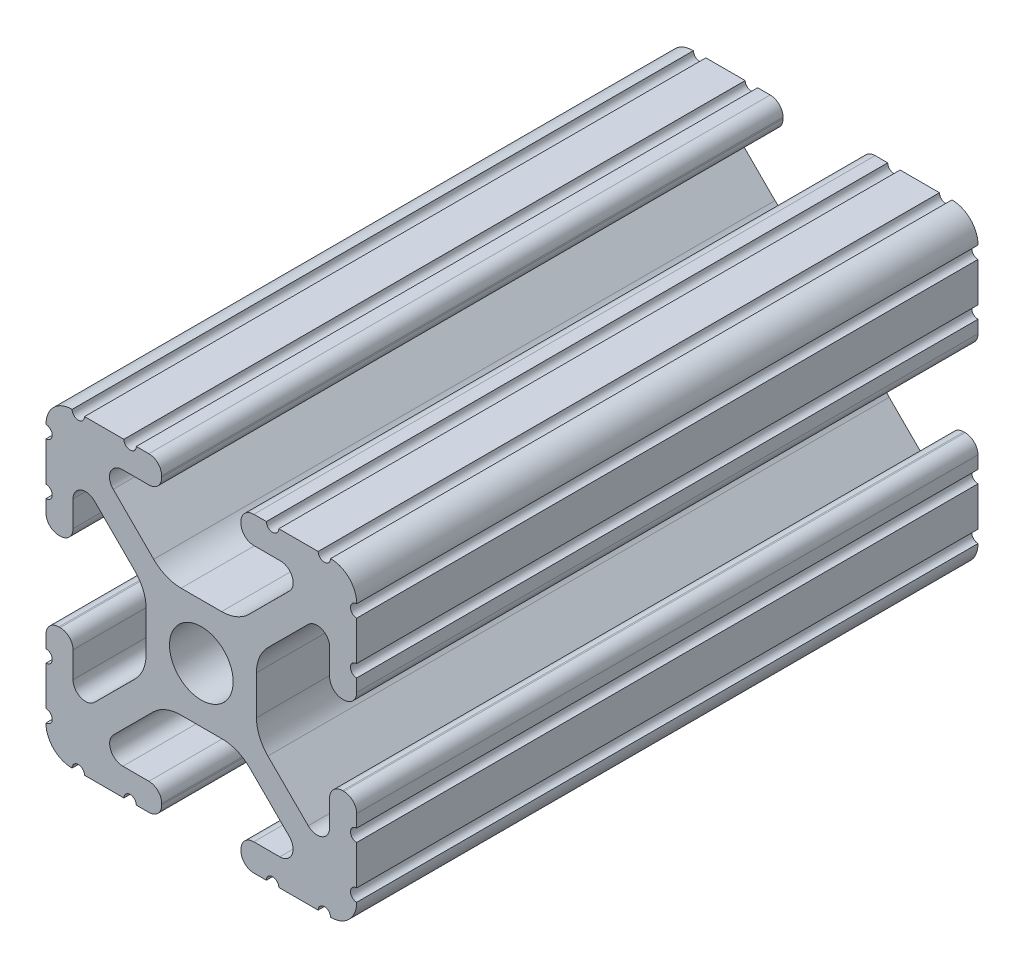
from build123d import *

# Parameters (mm, degrees)
SKETCH1_R           = 2.6035
BOSS_EXTRUDE1_DEPTH = 25.4


with BuildPart() as part:
    # Sketch1 → Boss-Extrude1 (new, symmetric)
    with BuildSketch(Plane.XY):
        with BuildLine():
            Line((-7.179650497, -8.645192506), (-3.952270251, -5.423690499))
            ThreePointArc((-3.952270251, -5.423690499), (-2.922936451, -4.736929036), (-1.709253557, -4.4958))
            Line((-1.709253557, -4.4958), (1.709253557, -4.4958))
            ThreePointArc((1.709253557, -4.4958), (2.922936451, -4.736929036), (3.952270251, -5.423690499))
            Line((3.952270251, -5.423690499), (7.179650497, -8.645192506))
            ThreePointArc((7.179650497, -8.645192506), (7.41473083, -9.822813117), (6.416408329, -10.4902))
            Line((6.416408329, -10.4902), (4.287512407, -10.4902))
            ThreePointArc((4.287512407, -10.4902), (3.54574862, -10.79744862), (3.2385, -11.539212407))
            Line((3.2385, -11.539212407), (3.2385, -11.650987593))
            ThreePointArc((3.2385, -11.650987593), (3.54574862, -12.39275138), (4.287512407, -12.7))
            Line((4.287512407, -12.7), (5.317126718, -12.7))
            ThreePointArc((5.317126718, -12.7), (5.825126718, -12.192), (6.333126718, -12.7))
            Line((6.333126718, -12.7), (9.550443118, -12.7))
            ThreePointArc((9.550443118, -12.7), (10.058366869, -12.192000006), (10.566443095, -12.699847501))
            ThreePointArc((10.566443095, -12.699847501), (12.082537762, -12.08250727), (12.699846982, -10.566399977))
            ThreePointArc((12.699846982, -10.566399977), (12.192000006, -10.058323491), (12.7, -9.5504))
            Line((12.7, -9.5504), (12.7, -6.3330836))
            ThreePointArc((12.7, -6.3330836), (12.192, -5.8250836), (12.7, -5.3170836))
            Line((12.7, -5.3170836), (12.7, -4.287469289))
            ThreePointArc((12.7, -4.287469289), (12.39275138, -3.545705502), (11.650987593, -3.238456882))
            Line((11.650987593, -3.238456882), (11.539212407, -3.238456882))
            ThreePointArc((11.539212407, -3.238456882), (10.79744862, -3.545705502), (10.4902, -4.287469289))
            Line((10.4902, -4.287469289), (10.4902, -6.402089023))
            ThreePointArc((10.4902, -6.402089023), (9.856505071, -7.351067942), (8.737131347, -7.129408934))
            Line((8.737131347, -7.129408934), (5.441005833, -3.840816462))
            ThreePointArc((5.441005833, -3.840816462), (4.750877967, -2.809883091), (4.5085, -1.593185507))
            Line((4.5085, -1.593185507), (4.5085, 1.593185507))
            ThreePointArc((4.5085, 1.593185507), (4.750877967, 2.809883091), (5.441005833, 3.840816462))
            Line((5.441005833, 3.840816462), (8.737131347, 7.129408934))
            ThreePointArc((8.737131347, 7.129408934), (9.856505071, 7.351067942), (10.4902, 6.402089023))
            Line((10.4902, 6.402089023), (10.4902, 4.287469289))
            ThreePointArc((10.4902, 4.287469289), (10.79744862, 3.545705502), (11.539212407, 3.238456882))
            Line((11.539212407, 3.238456882), (11.650987593, 3.238456882))
            ThreePointArc((11.650987593, 3.238456882), (12.39275138, 3.545705502), (12.7, 4.287469289))
            Line((12.7, 4.287469289), (12.7, 5.3170836))
            ThreePointArc((12.7, 5.3170836), (12.192, 5.8250836), (12.7, 6.3330836))
            Line((12.7, 6.3330836), (12.7, 9.5504))
            ThreePointArc((12.7, 9.5504), (12.192000006, 10.058323491), (12.699846982, 10.566399977))
            ThreePointArc((12.699846982, 10.566399977), (12.082537762, 12.08250727), (10.566443095, 12.699847501))
            ThreePointArc((10.566443095, 12.699847501), (10.058366869, 12.192000006), (9.550443118, 12.7))
            Line((9.550443118, 12.7), (6.333126718, 12.7))
            ThreePointArc((6.333126718, 12.7), (5.825126718, 12.192), (5.317126718, 12.7))
            Line((5.317126718, 12.7), (4.287512407, 12.7))
            ThreePointArc((4.287512407, 12.7), (3.54574862, 12.39275138), (3.2385, 11.650987593))
            Line((3.2385, 11.650987593), (3.2385, 11.539212407))
            ThreePointArc((3.2385, 11.539212407), (3.54574862, 10.79744862), (4.287512407, 10.4902))
            Line((4.287512407, 10.4902), (6.476788598, 10.4902))
            ThreePointArc((6.476788598, 10.4902), (7.432222385, 9.85140422), (7.207036008, 8.724370562))
            Line((7.207036008, 8.724370562), (3.898272566, 5.423169045))
            ThreePointArc((3.898272566, 5.423169045), (2.869120213, 4.736787962), (1.655778399, 4.4958))
            Line((1.655778399, 4.4958), (-1.655778399, 4.4958))
            ThreePointArc((-1.655778399, 4.4958), (-2.869120213, 4.736787962), (-3.898272566, 5.423169045))
            Line((-3.898272566, 5.423169045), (-7.207036008, 8.724370562))
            ThreePointArc((-7.207036008, 8.724370562), (-7.432222385, 9.85140422), (-6.476788598, 10.4902))
            Line((-6.476788598, 10.4902), (-4.287512407, 10.4902))
            ThreePointArc((-4.287512407, 10.4902), (-3.54574862, 10.79744862), (-3.2385, 11.539212407))
            Line((-3.2385, 11.539212407), (-3.2385, 11.650987593))
            ThreePointArc((-3.2385, 11.650987593), (-3.54574862, 12.39275138), (-4.287512407, 12.7))
            Line((-4.287512407, 12.7), (-5.317126718, 12.7))
            ThreePointArc((-5.317126718, 12.7), (-5.825126718, 12.192), (-6.333126718, 12.7))
            Line((-6.333126718, 12.7), (-9.550443118, 12.7))
            ThreePointArc((-9.550443118, 12.7), (-10.058366869, 12.192000006), (-10.566443095, 12.699847501))
            ThreePointArc((-10.566443095, 12.699847501), (-12.082537762, 12.08250727), (-12.699846982, 10.566399977))
            ThreePointArc((-12.699846982, 10.566399977), (-12.192000006, 10.058323491), (-12.7, 9.5504))
            Line((-12.7, 9.5504), (-12.7, 6.3330836))
            ThreePointArc((-12.7, 6.3330836), (-12.192, 5.8250836), (-12.7, 5.3170836))
            Line((-12.7, 5.3170836), (-12.7, 4.287469289))
            ThreePointArc((-12.7, 4.287469289), (-12.39275138, 3.545705502), (-11.650987593, 3.238456882))
            Line((-11.650987593, 3.238456882), (-11.539212407, 3.238456882))
            ThreePointArc((-11.539212407, 3.238456882), (-10.79744862, 3.545705502), (-10.4902, 4.287469289))
            Line((-10.4902, 4.287469289), (-10.4902, 6.402089023))
            ThreePointArc((-10.4902, 6.402089023), (-9.856505071, 7.351067942), (-8.737131347, 7.129408934))
            Line((-8.737131347, 7.129408934), (-5.441005833, 3.840816462))
            ThreePointArc((-5.441005833, 3.840816462), (-4.750877967, 2.809883091), (-4.5085, 1.593185507))
            Line((-4.5085, 1.593185507), (-4.5085, -1.593185507))
            ThreePointArc((-4.5085, -1.593185507), (-4.750877967, -2.809883091), (-5.441005833, -3.840816462))
            Line((-5.441005833, -3.840816462), (-8.737131347, -7.129408934))
            ThreePointArc((-8.737131347, -7.129408934), (-9.856505071, -7.351067942), (-10.4902, -6.402089023))
            Line((-10.4902, -6.402089023), (-10.4902, -4.287469289))
            ThreePointArc((-10.4902, -4.287469289), (-10.79744862, -3.545705502), (-11.539212407, -3.238456882))
            Line((-11.539212407, -3.238456882), (-11.650987593, -3.238456882))
            ThreePointArc((-11.650987593, -3.238456882), (-12.39275138, -3.545705502), (-12.7, -4.287469289))
            Line((-12.7, -4.287469289), (-12.7, -5.3170836))
            ThreePointArc((-12.7, -5.3170836), (-12.192, -5.8250836), (-12.7, -6.3330836))
            Line((-12.7, -6.3330836), (-12.7, -9.5504))
            ThreePointArc((-12.7, -9.5504), (-12.192000006, -10.058323491), (-12.699846982, -10.566399977))
            ThreePointArc((-12.699846982, -10.566399977), (-12.082537762, -12.08250727), (-10.566443095, -12.699847501))
            ThreePointArc((-10.566443095, -12.699847501), (-10.058366869, -12.192000006), (-9.550443118, -12.7))
            Line((-9.550443118, -12.7), (-6.333126718, -12.7))
            ThreePointArc((-6.333126718, -12.7), (-5.825126718, -12.192), (-5.317126718, -12.7))
            Line((-5.317126718, -12.7), (-4.287512407, -12.7))
            ThreePointArc((-4.287512407, -12.7), (-3.54574862, -12.39275138), (-3.2385, -11.650987593))
            Line((-3.2385, -11.650987593), (-3.2385, -11.539212407))
            ThreePointArc((-3.2385, -11.539212407), (-3.54574862, -10.79744862), (-4.287512407, -10.4902))
            Line((-4.287512407, -10.4902), (-6.416408329, -10.4902))
            ThreePointArc((-6.416408329, -10.4902), (-7.41473083, -9.822813117), (-7.179650497, -8.645192506))
        make_face()
        Circle(SKETCH1_R, mode=Mode.SUBTRACT)
    extrude(amount=BOSS_EXTRUDE1_DEPTH, both=True)


solid = part.part
